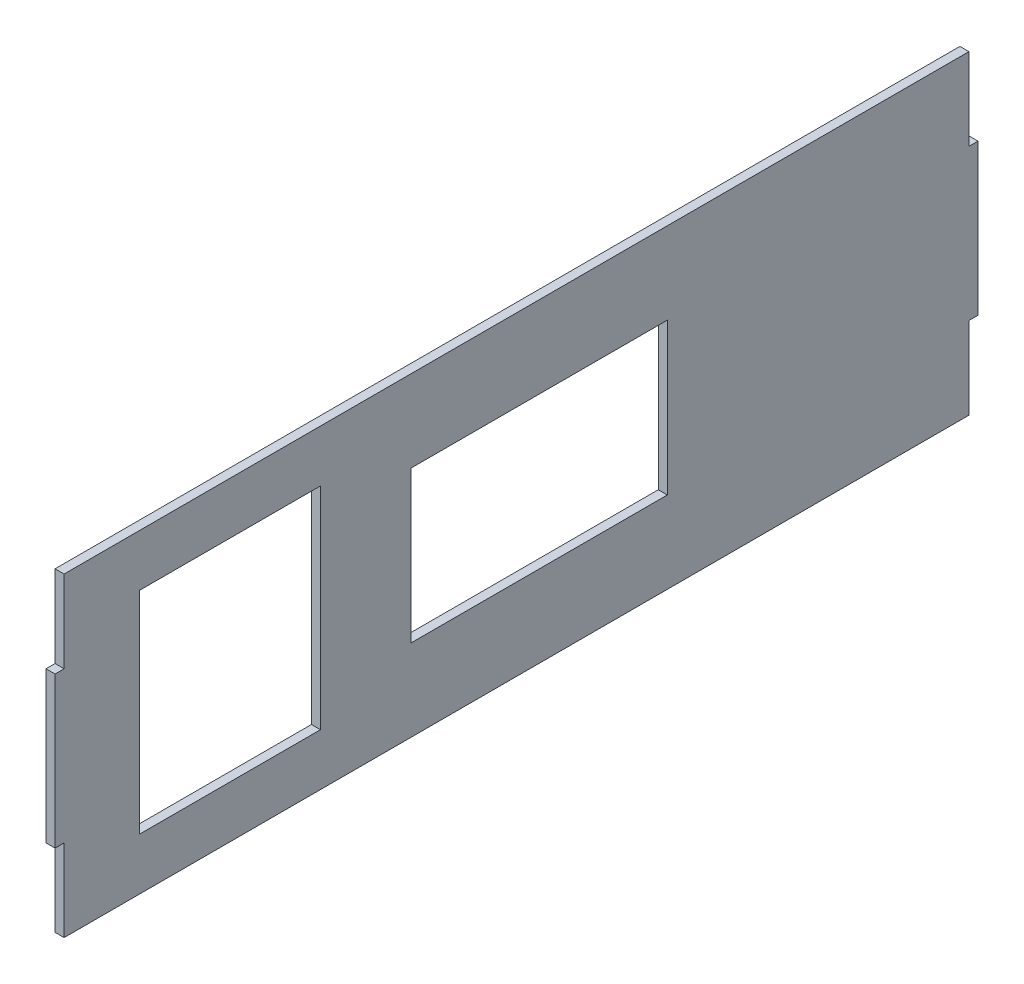
from build123d import *

# Parameters (mm, degrees)
BOSS_EXTRUDE1_DEPTH = 3
SKETCH2_W           = 60
SKETCH2_H           = 70
CUT_EXTRUDE1_DEPTH  = 10
SKETCH3_W           = 85
SKETCH3_H           = 50.2
CUT_EXTRUDE2_DEPTH  = 10


with BuildPart() as part:
    # Sketch1 → Boss-Extrude1 (new body)
    with BuildSketch(Plane(origin=(0, 0, 0), x_dir=(0, 0, -1), z_dir=(1, 0, 0))):
        Polygon((-174.354709419, 63.071743487), (125.645290581, 63.071743487), (125.645290581, 35.871743487), (128.645290581, 35.871743487), (128.645290581, -14.128256513), (125.645290581, -14.128256513), (125.645290581, -41.328256513), (-174.354709419, -41.328256513), (-174.354709419, -14.128256513), (-177.354709419, -14.128256513), (-177.354709419, 35.871743487), (-174.354709419, 35.871743487), align=None)
    extrude(amount=BOSS_EXTRUDE1_DEPTH)

    # Sketch2 → Cut-Extrude1 (cut)
    with BuildSketch(Plane(origin=(3, 0, 0), x_dir=(0, 0, -1), z_dir=(1, 0, 0))):
        with Locations((-119.354709419, 10.871743487)):
            Rectangle(SKETCH2_W, SKETCH2_H)
    extrude(amount=-CUT_EXTRUDE1_DEPTH, mode=Mode.SUBTRACT)

    # Sketch3 → Cut-Extrude2 (cut)
    with BuildSketch(Plane(origin=(3, 0, 0), x_dir=(0, 0, -1), z_dir=(1, 0, 0))):
        with Locations((-16.854709419, 10.871743487)):
            Rectangle(SKETCH3_W, SKETCH3_H)
    extrude(amount=-CUT_EXTRUDE2_DEPTH, mode=Mode.SUBTRACT)


solid = part.part
